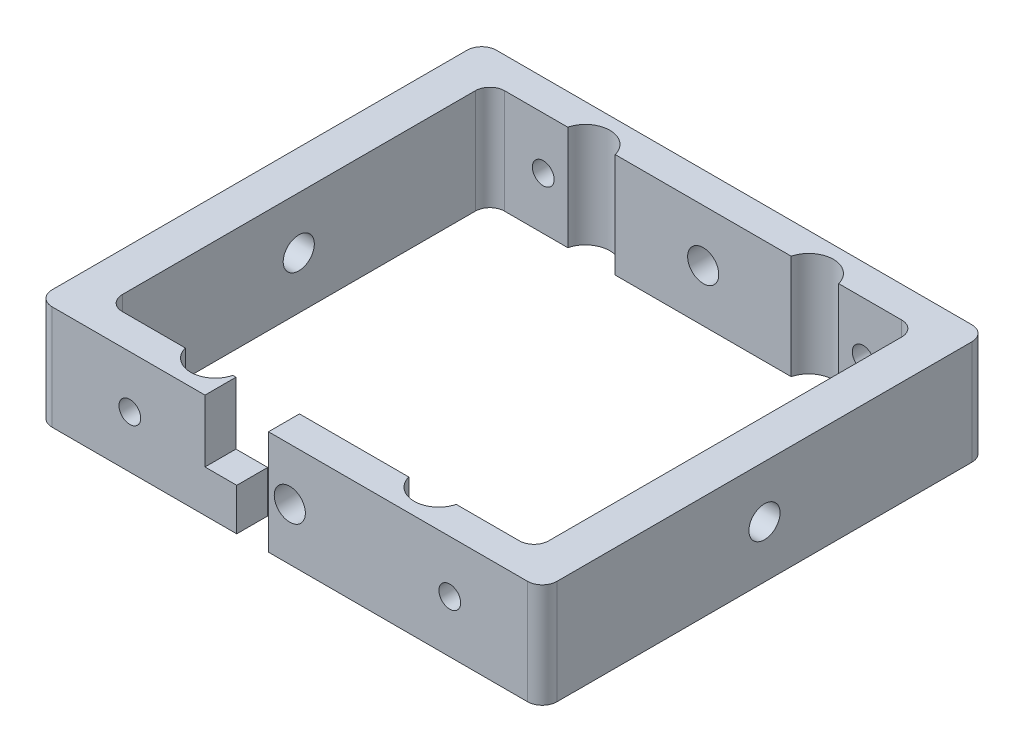
from build123d import *

# Parameters (mm, degrees)
SKETCH1_W           = 60
SKETCH1_H           = 6.32
BOSS_EXTRUDE1_DEPTH = 10.64
SKETCH2_R           = 5
CUT_EXTRUDE1_DEPTH  = 64.974845056
SKETCH3_W           = 6.32
SKETCH3_H           = 21.28
BOSS_EXTRUDE2_DEPTH = 21.5
SKETCH4_W           = 6.32
SKETCH4_H           = 21.28
BOSS_EXTRUDE3_DEPTH = 21.5
SKETCH5_W           = 8
SKETCH5_H           = 21.28
BOSS_EXTRUDE6_DEPTH = 84.33
SKETCH6_W           = 8
SKETCH6_H           = 21.291954735
BOSS_EXTRUDE7_DEPTH = 84.33
SKETCH7_W           = 6.32
SKETCH7_H           = 21.291954735
BOSS_EXTRUDE8_DEPTH = 95
SKETCH9_R           = 5
CUT_EXTRUDE2_DEPTH  = 120.193734049
SKETCH10_R          = 2.22
CUT_EXTRUDE3_DEPTH  = 123.364768784
FILLET1_R           = 3
SKETCH13_R          = 3.175
CUT_EXTRUDE4_DEPTH  = 123.364768784
SKETCH17_W          = 12.954
SKETCH17_H          = 7.031857888
CUT_EXTRUDE7_DEPTH  = 12.7
CUT_EXTRUDE8_REACH  = 124.365
SKETCH18_W          = 6.477
SKETCH18_H          = 8.58
SKETCH19_R          = 3.175
CUT_EXTRUDE9_DEPTH  = 134.544049061


with BuildPart() as part:
    # Sketch1 → Boss-Extrude1 (new, symmetric)
    with BuildSketch(Plane(origin=(0, 0, 0), x_dir=(1, 0, 0), z_dir=(0, 1, 0))):
        with Locations((30, -3.16)):
            Rectangle(SKETCH1_W, SKETCH1_H)
    extrude(amount=BOSS_EXTRUDE1_DEPTH, both=True)

    # Sketch2 → Cut-Extrude1 (cut, through all)
    with BuildSketch(Plane(origin=(0, 10.64, 0), x_dir=(1, 0, 0), z_dir=(0, 1, 0))):
        with Locations((7.21, 1.25)):
            Circle(SKETCH2_R)
        with Locations((52.79, 1.25)):
            Circle(SKETCH2_R)
    extrude(amount=-CUT_EXTRUDE1_DEPTH, mode=Mode.SUBTRACT)

    # Sketch3 → Boss-Extrude2 (add)
    with BuildSketch(Plane(origin=(60, 0, 0), x_dir=(0, 0, -1), z_dir=(1, 0, 0))):
        with Locations((-3.16, 0)):
            Rectangle(SKETCH3_W, SKETCH3_H)
    extrude(amount=BOSS_EXTRUDE2_DEPTH)

    # Sketch4 → Boss-Extrude3 (add)
    with BuildSketch(Plane.ZY):
        with Locations((3.16, 0)):
            Rectangle(SKETCH4_W, SKETCH4_H)
    extrude(amount=BOSS_EXTRUDE3_DEPTH)

    # Sketch5 → Boss-Extrude6 (add)
    with BuildSketch(Plane(origin=(0, 0, 0), x_dir=(-1, 0, 0), z_dir=(0, 0, -1))):
        with Locations((17.5, 0)):
            Rectangle(SKETCH5_W, SKETCH5_H)
    extrude(amount=BOSS_EXTRUDE6_DEPTH)

    # Sketch6 → Boss-Extrude7 (add)
    with BuildSketch(Plane(origin=(0, 0, 0), x_dir=(-1, 0, 0), z_dir=(0, 0, -1))):
        with Locations((-77.5, -0.005977367)):
            Rectangle(SKETCH6_W, SKETCH6_H)
    extrude(amount=BOSS_EXTRUDE7_DEPTH)

    # Sketch7 → Boss-Extrude8 (add, through all)
    with BuildSketch(Plane.ZY.offset(-73.5)):
        with Locations((-81.17, -0.005977367)):
            Rectangle(SKETCH7_W, SKETCH7_H)
    extrude(amount=BOSS_EXTRUDE8_DEPTH)

    # Sketch9 → Cut-Extrude2 (cut, through all)
    with BuildSketch(Plane(origin=(0, 10.64, 0), x_dir=(1, 0, 0), z_dir=(0, 1, 0))):
        with Locations((7.21, 76.76)):
            Circle(SKETCH9_R)
        with Locations((52.79, 76.76)):
            Circle(SKETCH9_R)
    extrude(amount=-CUT_EXTRUDE2_DEPTH, mode=Mode.SUBTRACT)

    # Sketch10 → Cut-Extrude3 (cut, through all)
    with BuildSketch(Plane(origin=(0, 0, -84.33), x_dir=(-1, 0, 0), z_dir=(0, 0, -1))):
        with Locations((-62.631229183, 0.005)):
            Circle(SKETCH10_R)
        with Locations((2.631229183, 0.005)):
            Circle(SKETCH10_R)
    extrude(amount=-CUT_EXTRUDE3_DEPTH, mode=Mode.SUBTRACT)

    # Fillet1
    fillet1_edges = [part.edges().sort_by_distance(p)[0] for p in [
        (81.5, 0, 6.32),
        (-21.5, 0, 6.32),
        (-13.5, 0, 0),
        (-21.5, -0.005977367, -84.33),
        (73.5, 0, 0),
        (81.5, -0.005977367, -84.33),
        (-13.5, 0, -78.01),
        (73.5, -0.005977367, -78.01),
    ]]
    fillet(fillet1_edges, radius=FILLET1_R)

    # Sketch13 → Cut-Extrude4 (cut, through all)
    with BuildSketch(Plane(origin=(0, 0, -84.33), x_dir=(-1, 0, 0), z_dir=(0, 0, -1))):
        with Locations((-30, 0.005)):
            Circle(SKETCH13_R)
    extrude(amount=-CUT_EXTRUDE4_DEPTH, mode=Mode.SUBTRACT)

    # Sketch17 → Cut-Extrude7 (cut, symmetric)
    with BuildSketch(Plane(origin=(0, 10.64, 0), x_dir=(1, 0, 0), z_dir=(0, 1, 0))):
        with Locations((19.173393665, -2.929761462)):
            Rectangle(SKETCH17_W, SKETCH17_H)
    extrude(amount=CUT_EXTRUDE7_DEPTH, both=True, mode=Mode.SUBTRACT)

    # Sketch18 → Cut-Extrude8 (cut, up to next)
    with BuildSketch(Plane.XY.offset(6.32), mode=Mode.PRIVATE) as cut_extrude8_sk1:
        with Locations((22.411893665, -6.35)):
            Rectangle(SKETCH18_W, SKETCH18_H)
    cut_extrude8_tool1 = extrude(cut_extrude8_sk1.sketch, amount=-CUT_EXTRUDE8_REACH, mode=Mode.PRIVATE) & part.part
    add(cut_extrude8_tool1.solids().sort_by_distance((22.411894, -6.35, 6.32))[0], mode=Mode.SUBTRACT)

    # Sketch19 → Cut-Extrude9 (cut, through all)
    with BuildSketch(Plane.ZY.offset(21.5)):
        with Locations((-39.005, 0)):
            Circle(SKETCH19_R)
    extrude(amount=-CUT_EXTRUDE9_DEPTH, mode=Mode.SUBTRACT)


solid = part.part
